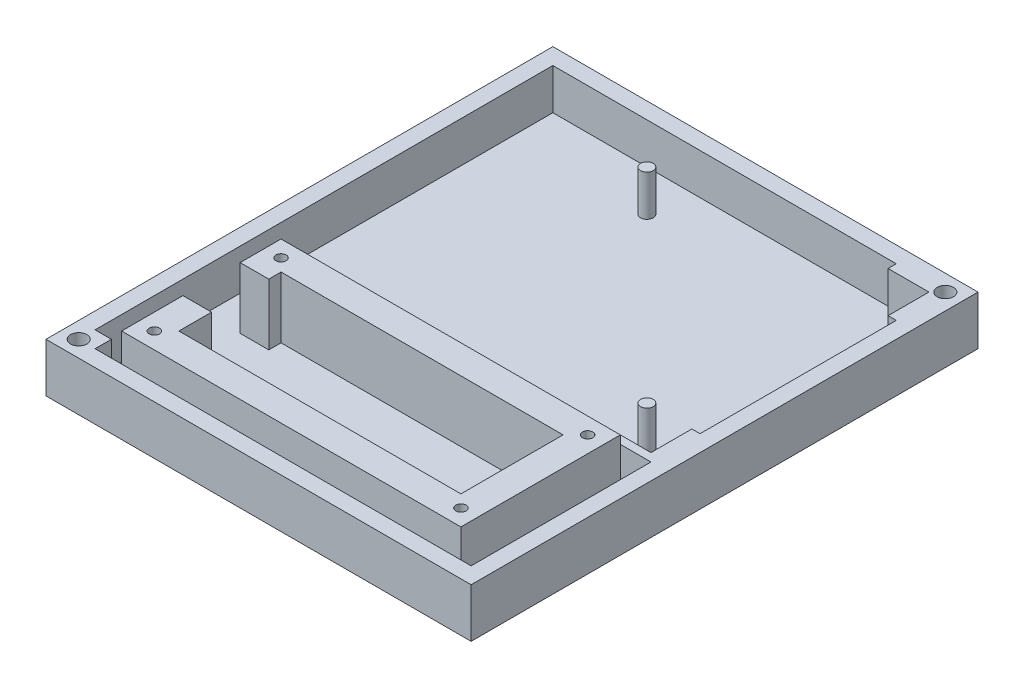
from build123d import *

# Parameters (mm, degrees)
SKETCH1_W           = 104
SKETCH1_H           = 124
BOSS_EXTRUDE1_DEPTH = 2
SKETCH2_W           = 104
SKETCH2_H           = 124
SKETCH2_R           = 2
SKETCH2_R_2         = 1.55
BOSS_EXTRUDE2_DEPTH = 10
SKETCH3_R           = 1.25
BOSS_EXTRUDE3_DEPTH = 15


with BuildPart() as part:
    # Sketch1 → Boss-Extrude1 (new body)
    with BuildSketch(Plane(origin=(0, 0, 0), x_dir=(1, 0, 0), z_dir=(0, 1, 0))):
        Rectangle(SKETCH1_W, SKETCH1_H)
    extrude(amount=BOSS_EXTRUDE1_DEPTH)

    # Sketch2 → Boss-Extrude2 (add)
    # profile 1 of 3: a face of its own
    with BuildSketch(Plane(origin=(0, 2, 0), x_dir=(1, 0, 0), z_dir=(0, 1, 0))):
        Rectangle(SKETCH2_W, SKETCH2_H)
        Polygon((36, -14), (48, -14), (48, -58), (-44, -58), (-44, -54), (-48, -54), (-48, 58), (36, 58), (36, 56), (46, 56), (46, 46), (48, 46), (48, -2), (46, -2), (46, -12), (36, -12), align=None, mode=Mode.SUBTRACT)
        with Locations(Location((48, 58, 0), (0, 0, 270))):
            Circle(SKETCH2_R, mode=Mode.SUBTRACT)
        with Locations(Location((-48, -58, 0), (0, 0, 270))):
            Circle(SKETCH2_R, mode=Mode.SUBTRACT)
    # profile 2 of 3: a face of its own
    with BuildSketch(Plane(origin=(0, 2, 0), x_dir=(1, 0, 0), z_dir=(0, 1, 0))):
        with Locations(Location((-15, 48, 0), (0, 0, 90))):
            Circle(SKETCH2_R_2)
    # profile 3 of 3: a face of its own
    with BuildSketch(Plane(origin=(0, 2, 0), x_dir=(1, 0, 0), z_dir=(0, 1, 0))):
        with Locations(Location((35, -2, 0), (0, 0, 90))):
            Circle(SKETCH2_R_2)
    extrude(amount=BOSS_EXTRUDE2_DEPTH)

    # Sketch3 → Boss-Extrude3 (add)
    with BuildSketch(Plane(origin=(0, 2, 0), x_dir=(1, 0, 0), z_dir=(0, 1, 0))):
        Polygon((36.5, -49), (-32.5, -49), (-32.5, -41), (-39.5, -41), (-39.5, -56), (43.5, -56), (43.5, -17), (-39.5, -17), (-39.5, -27), (-32.5, -27), (-32.5, -24), (36.5, -24), align=None)
        with Locations(Location((-35.5, -52, 0), (0, 0, 270))):
            Circle(SKETCH3_R, mode=Mode.SUBTRACT)
        with Locations(Location((39.5, -52, 0), (0, 0, 270))):
            Circle(SKETCH3_R, mode=Mode.SUBTRACT)
        with Locations(Location((-35.5, -21, 0), (0, 0, 270))):
            Circle(SKETCH3_R, mode=Mode.SUBTRACT)
        with Locations(Location((39.5, -21, 0), (0, 0, 270))):
            Circle(SKETCH3_R, mode=Mode.SUBTRACT)
    extrude(amount=BOSS_EXTRUDE3_DEPTH)


solid = part.part
